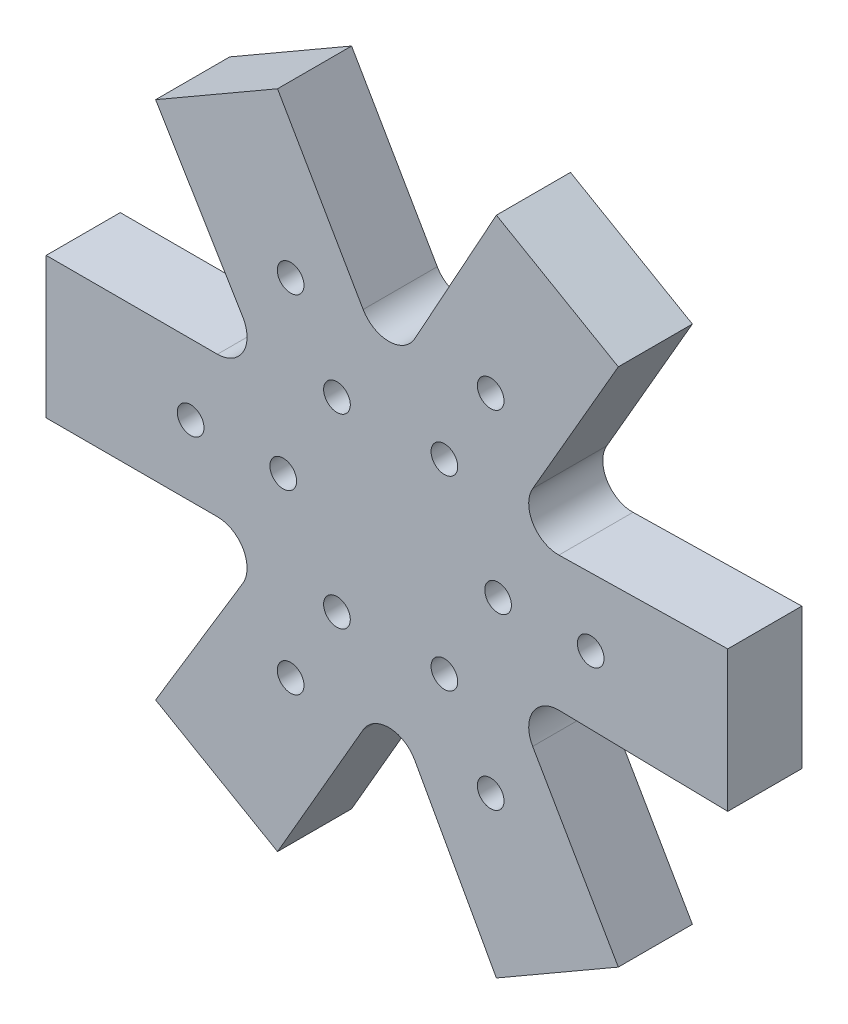
from build123d import *

# Parameters (mm, degrees)
BOSS_EXTRUDE2_DEPTH = 5
CUT_EXTRUDE5_DEPTH  = 2.5
SKETCH8_R           = 0.9
CUT_EXTRUDE6_DEPTH  = 33.308147585


with BuildPart() as part:
    # Sketch1 → Boss-Extrude2 (new body)
    with BuildSketch(Plane.XY):
        with BuildLine():
            Line((-23.25, 4.75), (-23.25, -4.75))
            Line((-23.25, -4.75), (-11.691342951, -4.75))
            ThreePointArc((-11.691342951, -4.75), (-9.949887623, -5.766468943), (-9.978567551, -7.78266666))
            Line((-9.978567551, -7.78266666), (-15.863620668, -17.543584287))
            Line((-15.863620668, -17.543584287), (-7.636379332, -22.293584287))
            Line((-7.636379332, -22.293584287), (-1.857050808, -12.283493649))
            ThreePointArc((-1.857050808, -12.283493649), (-0.106035217, -11.283583567), (1.625703261, -12.316519972))
            Line((1.625703261, -12.316519972), (7.136379332, -22.293584287))
            Line((7.136379332, -22.293584287), (15.363620668, -17.543584287))
            Line((15.363620668, -17.543584287), (9.584292144, -7.533493649))
            ThreePointArc((9.584292144, -7.533493649), (9.593852406, -5.517114624), (11.354270812, -4.533853312))
            Line((11.354270812, -4.533853312), (22.75, -4.75))
            Line((22.75, -4.75), (22.75, 4.75))
            Line((22.75, 4.75), (11.354270812, 4.533853312))
            ThreePointArc((11.354270812, 4.533853312), (9.593852406, 5.517114624), (9.584292144, 7.533493649))
            Line((9.584292144, 7.533493649), (15.363620668, 17.543584287))
            Line((15.363620668, 17.543584287), (7.136379332, 22.293584287))
            Line((7.136379332, 22.293584287), (1.625703261, 12.316519972))
            ThreePointArc((1.625703261, 12.316519972), (-0.106035217, 11.283583567), (-1.857050808, 12.283493649))
            Line((-1.857050808, 12.283493649), (-7.636379332, 22.293584287))
            Line((-7.636379332, 22.293584287), (-15.863620668, 17.543584287))
            Line((-15.863620668, 17.543584287), (-9.978567551, 7.78266666))
            ThreePointArc((-9.978567551, 7.78266666), (-9.949887623, 5.766468943), (-11.691342951, 4.75))
            Line((-11.691342951, 4.75), (-23.25, 4.75))
        make_face()
    extrude(amount=BOSS_EXTRUDE2_DEPTH)

    # Sketch7 → Cut-Extrude5 (cut)
    with BuildSketch(Plane(origin=(0, 0, 0), x_dir=(-1, 0, 0), z_dir=(0, 0, -1))):
        with BuildLine():
            Line((-6.859008781, 3.960050566), (-9.849329973, 11.622556693))
            ThreePointArc((-9.849329973, 11.622556693), (-8.6625, 15.003890121), (-5.140764367, 14.341048313))
            Line((-5.140764367, 14.341048313), (0, 7.920101132))
            Line((0, 7.920101132), (5.140764367, 14.341048313))
            ThreePointArc((5.140764367, 14.341048313), (8.6625, 15.003890121), (9.849329973, 11.622556693))
            Line((9.849329973, 11.622556693), (6.859008781, 3.960050566))
            Line((6.859008781, 3.960050566), (14.99009434, 2.71849162))
            ThreePointArc((14.99009434, 2.71849162), (17.325, 0), (14.99009434, -2.71849162))
            Line((14.99009434, -2.71849162), (6.859008781, -3.960050566))
            Line((6.859008781, -3.960050566), (9.849329973, -11.622556693))
            ThreePointArc((9.849329973, -11.622556693), (8.6625, -15.003890121), (5.140764367, -14.341048313))
            Line((5.140764367, -14.341048313), (0, -7.920101132))
            Line((0, -7.920101132), (-5.140764367, -14.341048313))
            ThreePointArc((-5.140764367, -14.341048313), (-8.6625, -15.003890121), (-9.849329973, -11.622556693))
            Line((-9.849329973, -11.622556693), (-6.859008781, -3.960050566))
            Line((-6.859008781, -3.960050566), (-14.99009434, -2.71849162))
            ThreePointArc((-14.99009434, -2.71849162), (-17.325, 0), (-14.99009434, 2.71849162))
            Line((-14.99009434, 2.71849162), (-6.859008781, 3.960050566))
        make_face()
    extrude(amount=-CUT_EXTRUDE5_DEPTH, mode=Mode.SUBTRACT)

    # Sketch8 → Cut-Extrude6 (cut, through all)
    with BuildSketch(Plane(origin=(0, 0, 2.5), x_dir=(-1, 0, 0), z_dir=(0, 0, -1))):
        with Locations((7.25, 0)):
            Circle(SKETCH8_R)
        with Locations((13.5, 0)):
            Circle(SKETCH8_R)
        with Locations((6.75, -11.691342951)):
            Circle(SKETCH8_R)
        with Locations((3.625, -6.278684177)):
            Circle(SKETCH8_R)
        with Locations((-6.75, -11.691342951)):
            Circle(SKETCH8_R)
        with Locations((-3.625, -6.278684177)):
            Circle(SKETCH8_R)
        with Locations((-13.5, 0)):
            Circle(SKETCH8_R)
        with Locations((-7.25, 0)):
            Circle(SKETCH8_R)
        with Locations((-6.75, 11.691342951)):
            Circle(SKETCH8_R)
        with Locations((-3.625, 6.278684177)):
            Circle(SKETCH8_R)
        with Locations((6.75, 11.691342951)):
            Circle(SKETCH8_R)
        with Locations((3.625, 6.278684177)):
            Circle(SKETCH8_R)
    extrude(amount=-CUT_EXTRUDE6_DEPTH, mode=Mode.SUBTRACT)


solid = part.part
